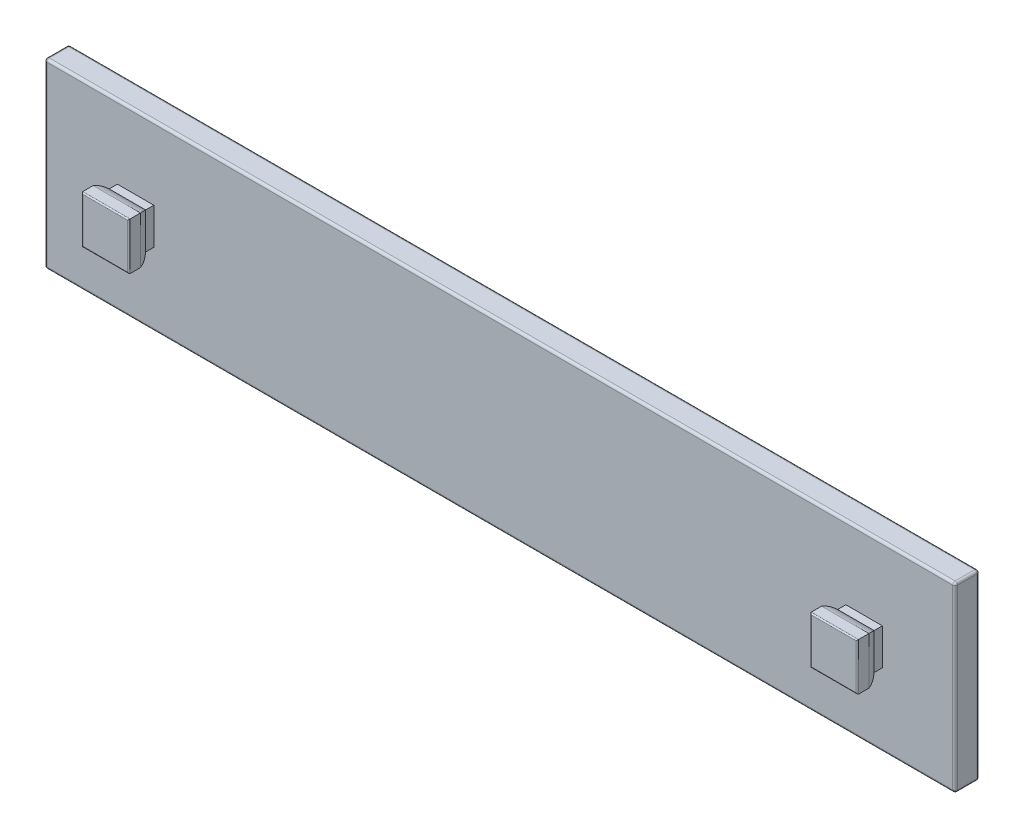
from build123d import *

# Parameters (mm, degrees)
SKETCH_1_W           = 75
SKETCH_1_H           = 15
EXTRUDE_1_DEPTH      = 2
SKETCH_2_W           = 3
SKETCH_2_H           = 3
EXTRUDE_2_DEPTH      = 1
EXTRUDE_3_DEPTH      = 2
EXTRUDE_3_DEPTH_BACK = 2
CUT_EXTRUDE_1_DEPTH  = 70.898515721
FILLET_1_R           = 0.1
FILLET_2_R           = 0.2


with BuildPart() as part:
    # 草图1 → 凸台-拉伸1 (new body)
    with BuildSketch(Plane.XY):
        Rectangle(SKETCH_1_W, SKETCH_1_H)
    extrude(amount=-EXTRUDE_1_DEPTH)

    # 草图2 → 凸台-拉伸2 (add)
    with BuildSketch(Plane.XY):
        with Locations((-30, 0)):
            Rectangle(SKETCH_2_W, SKETCH_2_H)
        with Locations((30, 0)):
            Rectangle(SKETCH_2_W, SKETCH_2_H)
    extrude(amount=EXTRUDE_2_DEPTH)

    # 草图3 → 凸台-拉伸3 (add, two sides: drawn at the far end of the back side and taken through both)
    with BuildSketch(Plane.XZ.offset(-EXTRUDE_3_DEPTH_BACK)):
        with BuildLine():
            Line((-31.95, 2.5), (-28.05, 2.5))
            Line((-28.05, 2.5), (-28.05, 1.555590279))
            ThreePointArc((-28.05, 1.555590279), (-28.219957697, 1.088161527), (-28.5, 0.677124344))
            Line((-28.5, 0.677124344), (-31.5, 0.677124344))
            ThreePointArc((-31.5, 0.677124344), (-31.780042303, 1.088161527), (-31.95, 1.555590279))
            Line((-31.95, 1.555590279), (-31.95, 2.5))
        make_face()
        with BuildLine():
            Line((31.5, 0.677124344), (28.5, 0.677124344))
            ThreePointArc((28.5, 0.677124344), (28.219957697, 1.088161527), (28.05, 1.555590279))
            Line((28.05, 1.555590279), (28.05, 2.5))
            Line((28.05, 2.5), (31.95, 2.5))
            Line((31.95, 2.5), (31.95, 1.555590279))
            ThreePointArc((31.95, 1.555590279), (31.780042303, 1.088161527), (31.5, 0.677124344))
        make_face()
    extrude(amount=EXTRUDE_3_DEPTH + EXTRUDE_3_DEPTH_BACK)

    # 草图4 → 切除-拉伸1 (cut, through all)
    with BuildSketch(Plane.ZY.offset(31.95)):
        with BuildLine():
            Line((2.5, 1.95), (1.555590279, 1.95))
            ThreePointArc((1.555590279, 1.95), (1.088161527, 1.780042303), (0.677124344, 1.5))
            Line((0.677124344, 1.5), (0.677124344, 2))
            Line((0.677124344, 2), (2.5, 2))
            Line((2.5, 2), (2.5, 1.95))
        make_face()
        with BuildLine():
            Line((0.677124344, -2), (2.5, -2))
            Line((2.5, -2), (2.5, -1.95))
            Line((2.5, -1.95), (1.555590279, -1.95))
            ThreePointArc((1.555590279, -1.95), (1.088161527, -1.780042303), (0.677124344, -1.5))
            Line((0.677124344, -1.5), (0.677124344, -2))
        make_face()
    extrude(amount=-CUT_EXTRUDE_1_DEPTH, mode=Mode.SUBTRACT)

    # 圆角1
    fillet_1_edges = [part.edges().sort_by_distance(p)[0] for p in [
        (-30, -1.95, 2.5),
        (30, -1.95, 2.5),
        (31.95, 0, 2.5),
        (28.05, 0, 2.5),
        (-28.05, 0, 2.5),
        (-31.95, 0, 2.5),
        (-30, 1.95, 2.5),
        (30, 1.95, 2.5),
    ]]
    fillet(fillet_1_edges, radius=FILLET_1_R)

    # 圆角2
    fillet_2_edges = [part.edges().sort_by_distance(p)[0] for p in [
        (37.5, 0, -2),
        (0, 7.5, -2),
        (-37.5, 0, -2),
        (0, 7.5, 0),
        (37.5, 0, 0),
        (0, -7.5, 0),
        (-37.5, 0, 0),
        (0, -7.5, -2),
        (-37.5, 7.5, -1),
        (37.5, 7.5, -1),
        (37.5, -7.5, -1),
        (-37.5, -7.5, -1),
    ]]
    fillet(fillet_2_edges, radius=FILLET_2_R)


solid = part.part
